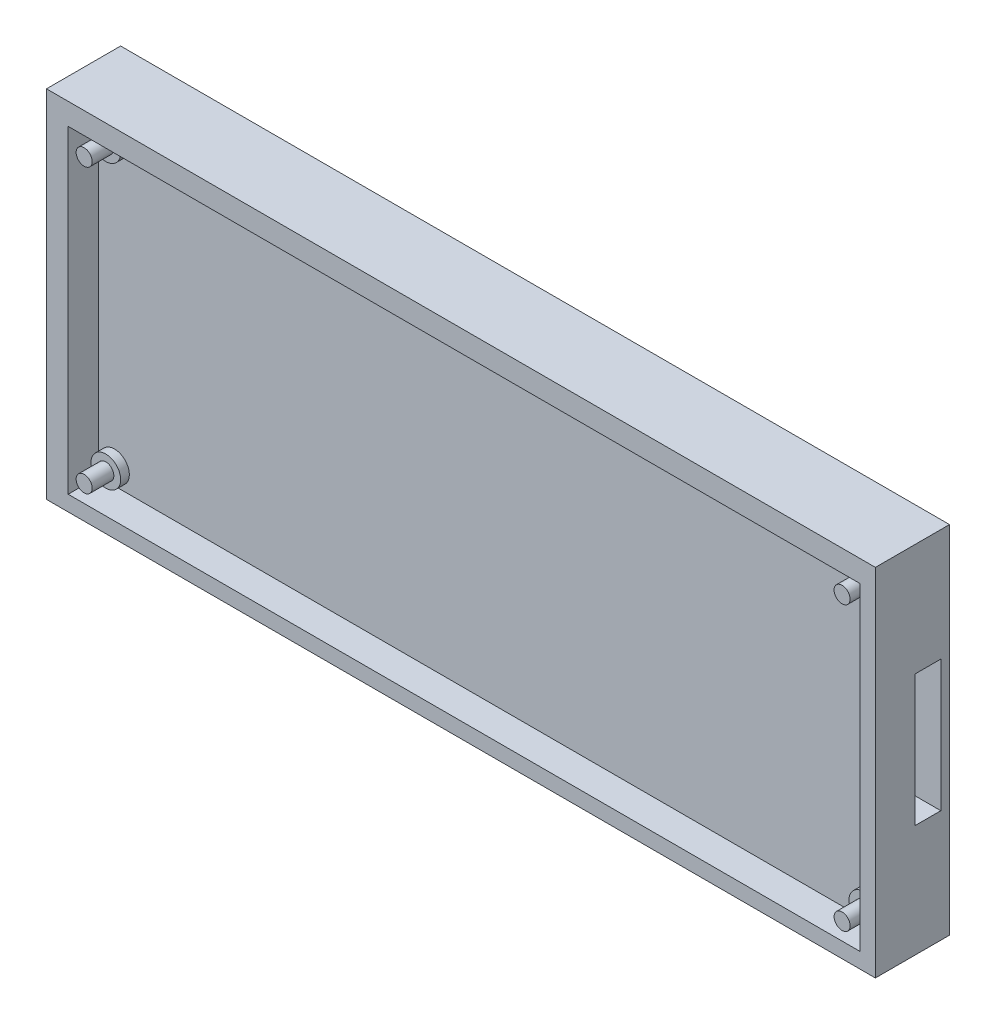
from build123d import *

# Parameters (mm, degrees)
BOSS_EXTRUDE1_DEPTH      = 5
BOSS_EXTRUDE1_DEPTH_BACK = 0.093151617
SKETCH1_W                = 182.5752
SKETCH1_H                = 73.4568
SKETCH2_R                = 3.416363386
BOSS_EXTRUDE2_DEPTH      = 7
SKETCH3_R                = 1.85
BOSS_EXTRUDE3_DEPTH      = 5
SKETCH4_W                = 191.110733906
SKETCH4_H                = 81.992333906
SKETCH4_W_2              = 182.5752
SKETCH4_H_2              = 73.4568
BOSS_EXTRUDE4_DEPTH      = 12
SKETCH5_W                = 191.110733906
SKETCH5_H                = 81.992333906
BOSS_EXTRUDE5_DEPTH      = 5.093151617
SKETCH7_W                = 182.5752
SKETCH7_H                = 73.4568
BOSS_EXTRUDE7_DEPTH      = 5
CUT_EXTRUDE1_START       = -2
CUT_EXTRUDE1_DEPTH       = 6


with BuildPart() as part:
    # Sketch1 → Boss-Extrude1 (new, two sides: drawn at the far end of the back side and taken through both)
    with BuildSketch(Plane.XY.offset(-BOSS_EXTRUDE1_DEPTH_BACK)):
        with Locations((-10.337299282, 18.489677755)):
            Rectangle(SKETCH1_W, SKETCH1_H)
    extrude(amount=BOSS_EXTRUDE1_DEPTH + BOSS_EXTRUDE1_DEPTH_BACK)

    # Sketch2 → Boss-Extrude2 (add)
    with BuildSketch(Plane.XY.offset(5)):
        with Locations((-97.941899282, 50.950877755)):
            Circle(SKETCH2_R)
        with Locations((76.810100718, 50.950877755)):
            Circle(SKETCH2_R)
        with Locations((76.810100718, -14.276322245)):
            Circle(SKETCH2_R)
        with Locations((-97.941899282, -14.276322245)):
            Circle(SKETCH2_R)
    extrude(amount=BOSS_EXTRUDE2_DEPTH)

    # Sketch3 → Boss-Extrude3 (add)
    with BuildSketch(Plane.XY.offset(12)):
        with Locations((-97.941899282, 50.950877755)):
            Circle(SKETCH3_R)
        with Locations((-97.941899282, -14.276322245)):
            Circle(SKETCH3_R)
        with Locations((76.810100718, -14.276322245)):
            Circle(SKETCH3_R)
        with Locations((76.810100718, 50.950877755)):
            Circle(SKETCH3_R)
    extrude(amount=BOSS_EXTRUDE3_DEPTH)



with BuildPart() as body_2:
    # Sketch4 → Boss-Extrude4 (new body)
    with BuildSketch(Plane.XY.offset(5)):
        with Locations((-11.069532329, 19.221910802)):
            Rectangle(SKETCH4_W, SKETCH4_H)
        with Locations((-10.337299282, 18.489677755)):
            Rectangle(SKETCH4_W_2, SKETCH4_H_2, mode=Mode.SUBTRACT)
    extrude(amount=BOSS_EXTRUDE4_DEPTH)


with BuildPart() as part_1:
    add(part.part)

    add(body_2.part)  # Boss-Extrude5 merges body 2
    # Sketch5 → Boss-Extrude5 (add)
    with BuildSketch(Plane(origin=(0, 0, 5), x_dir=(-1, 0, 0), z_dir=(0, 0, -1))):
        with Locations((11.069532329, 19.221910802)):
            Rectangle(SKETCH5_W, SKETCH5_H)
    extrude(amount=BOSS_EXTRUDE5_DEPTH)

    # Sketch7 → Boss-Extrude7 (add)
    with BuildSketch(Plane.XY.offset(5)):
        with Locations((-10.337299282, 18.489677755)):
            Rectangle(SKETCH7_W, SKETCH7_H)
    extrude(amount=BOSS_EXTRUDE7_DEPTH)

    # Sketch6 → Cut-Extrude1 (cut)
    with BuildSketch(Plane(origin=(0, 0, -0.093151617), x_dir=(-1, 0, 0), z_dir=(0, 0, -1)).offset(CUT_EXTRUDE1_START)):
        Polygon((-84.485834624, 34.360708249), (-84.485834624, 4.083113354), (-66.229962778, 4.083113354), (-66.229962778, 0.271521895), (-63.510633591, 0.271521895), (-56.864299396, 4.083113354), (-56.864299396, 34.360708249), (-63.510633591, 38.172299708), (-66.229962778, 38.172299708), (-66.229962778, 34.360708249), align=None)
    cut_extrude1 = extrude(amount=-CUT_EXTRUDE1_DEPTH, mode=Mode.SUBTRACT)

    # Mirror1: Cut-Extrude1 across plane
    add(cut_extrude1.mirror(Plane(origin=(-11.069532329, 0, 0), x_dir=(0, 0, 1), z_dir=(1, 0, 0))), mode=Mode.SUBTRACT)


solid = part_1.part
